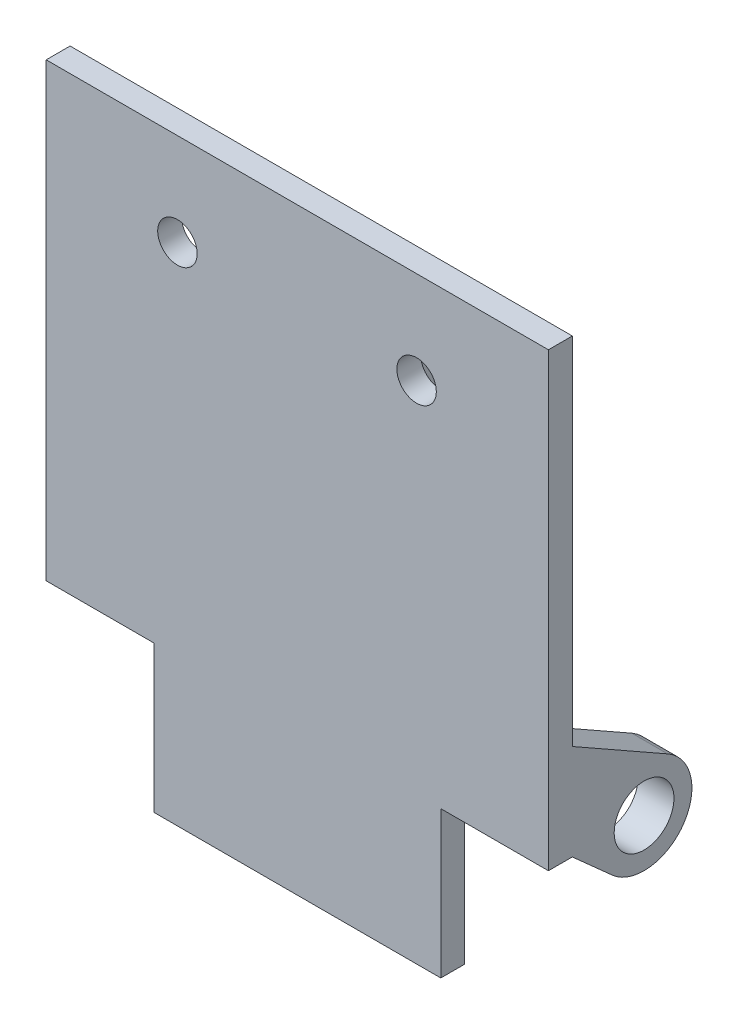
from build123d import *

# Parameters (mm, degrees)
SKETCH_1_W          = 42
SKETCH_1_H          = 50
EXTRUDE_1_DEPTH     = 2
SKETCH_3_W          = 3
SKETCH_3_H          = 6
EXTRUDE_2_DEPTH     = 12
FILLET_1_R          = 5
FILLET_2_R          = 5
SKETCH_4_R          = 1
CUT_EXTRUDE_1_DEPTH = 39.013155617
SKETCH_5_R          = 2.5
EXTRUDE_3_DEPTH     = 3
SKETCH_6_W          = 9
SKETCH_6_H          = 12.266046359
CUT_EXTRUDE_2_DEPTH = 35.785054262
SKETCH_7_R          = 1.65
CUT_EXTRUDE_3_DEPTH = 36.524639337
FILLET_3_R          = 3


with BuildPart() as part:
    # 草图1 → 凸台-拉伸1 (new body)
    with BuildSketch(Plane.XY):
        Rectangle(SKETCH_1_W, SKETCH_1_H)
    extrude(amount=EXTRUDE_1_DEPTH)

    # 草图3 → 凸台-拉伸2 (add)
    with BuildSketch(Plane(origin=(0, 0, 0), x_dir=(-1, 0, 0), z_dir=(0, 0, -1))):
        with Locations((3.5, -22)):
            Rectangle(SKETCH_3_W, SKETCH_3_H)
        with Locations((3.5, 7)):
            Rectangle(SKETCH_3_W, SKETCH_3_H)
    extrude(amount=EXTRUDE_2_DEPTH)

    # 圆角1
    fillet_1_edges = [part.edges().sort_by_distance(p)[0] for p in [
        (-2, 7, 0),
    ]]
    fillet(fillet_1_edges, radius=FILLET_1_R)

    # 圆角2
    fillet_2_edges = [part.edges().sort_by_distance(p)[0] for p in [
        (-2, -22, 0),
    ]]
    fillet(fillet_2_edges, radius=FILLET_2_R)

    # 草图4 → 切除-拉伸1 (cut, through all)
    with BuildSketch(Plane.ZY.offset(5)):
        with Locations((-6.9, -20.6)):
            Circle(SKETCH_4_R)
        with Locations((-6.9, 6.3)):
            Circle(SKETCH_4_R)
    extrude(amount=-CUT_EXTRUDE_1_DEPTH, mode=Mode.SUBTRACT)

    # 草图5 → 凸台-拉伸3 (add)
    with BuildSketch(Plane(origin=(21, 0, 0), x_dir=(0, 0, -1), z_dir=(1, 0, 0))):
        with BuildLine():
            Line((0, -4.733953641), (0, -12.733953641))
            Line((0, -12.733953641), (3.333333333, -15.715377611))
            ThreePointArc((3.333333333, -15.715377611), (9.249103106, -15.067047939), (7.972848445, -9.254317307))
            Line((7.972848445, -9.254317307), (0, -4.733953641))
        make_face()
        with Locations(Location((6, -12.733953641, 0), (0, 0, 90))):
            Circle(SKETCH_5_R, mode=Mode.SUBTRACT)
    extrude(amount=-EXTRUDE_3_DEPTH)

    # 草图6 → 切除-拉伸2 (cut, through all)
    with BuildSketch(Plane(origin=(0, 0, 0), x_dir=(-1, 0, 0), z_dir=(0, 0, -1))):
        with Locations((-16.5, -18.86697682)):
            Rectangle(SKETCH_6_W, SKETCH_6_H)
        with Locations((16.5, -18.86697682)):
            Rectangle(SKETCH_6_W, SKETCH_6_H)
    extrude(amount=-CUT_EXTRUDE_2_DEPTH, mode=Mode.SUBTRACT)

    # 草图7 → 切除-拉伸3 (cut, through all)
    with BuildSketch(Plane.XY.offset(2)):
        with Locations((9.975799492, 17.266046359)):
            Circle(SKETCH_7_R)
        with Locations((-10.024200508, 17.266046359)):
            Circle(SKETCH_7_R)
    extrude(amount=-CUT_EXTRUDE_3_DEPTH, mode=Mode.SUBTRACT)

    # 圆角3
    fillet_3_edges = [part.edges().sort_by_distance(p)[0] for p in [
        (-3.5, -25, -12),
    ]]
    fillet(fillet_3_edges, radius=FILLET_3_R)


solid = part.part
